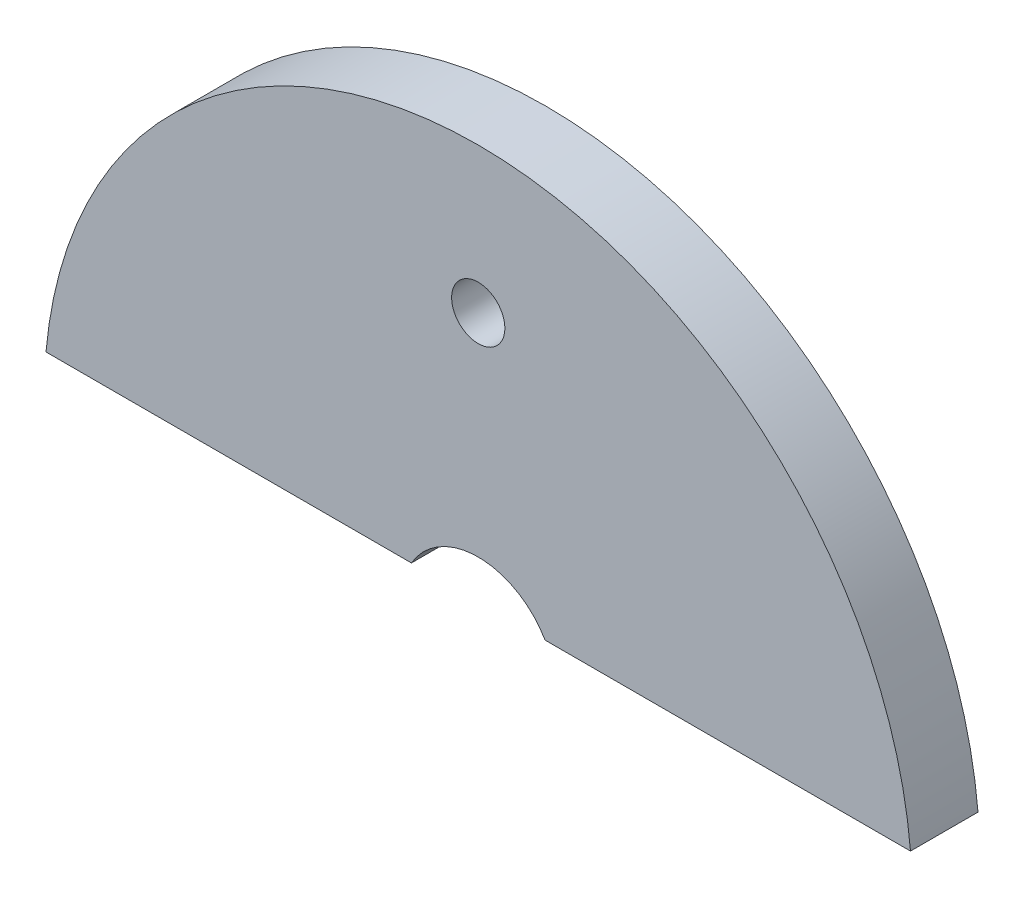
from build123d import *

# Parameters (mm, degrees)
SKETCH1_R           = 1.7526
BOSS_EXTRUDE1_DEPTH = 4.445


with BuildPart() as part:
    # Sketch1 → Boss-Extrude1 (new body)
    with BuildSketch(Plane.XY):
        with BuildLine():
            ThreePointArc((28.461887235, 2.54), (0, 28.575), (-28.461887235, 2.54))
            Line((-28.461887235, 2.54), (-4.399409051, 2.54))
            ThreePointArc((-4.399409051, 2.54), (0, 5.08), (4.399409051, 2.54))
            Line((4.399409051, 2.54), (28.461887235, 2.54))
        make_face()
        with Locations((0, 18.9992)):
            Circle(SKETCH1_R, mode=Mode.SUBTRACT)
    extrude(amount=BOSS_EXTRUDE1_DEPTH)


solid = part.part
